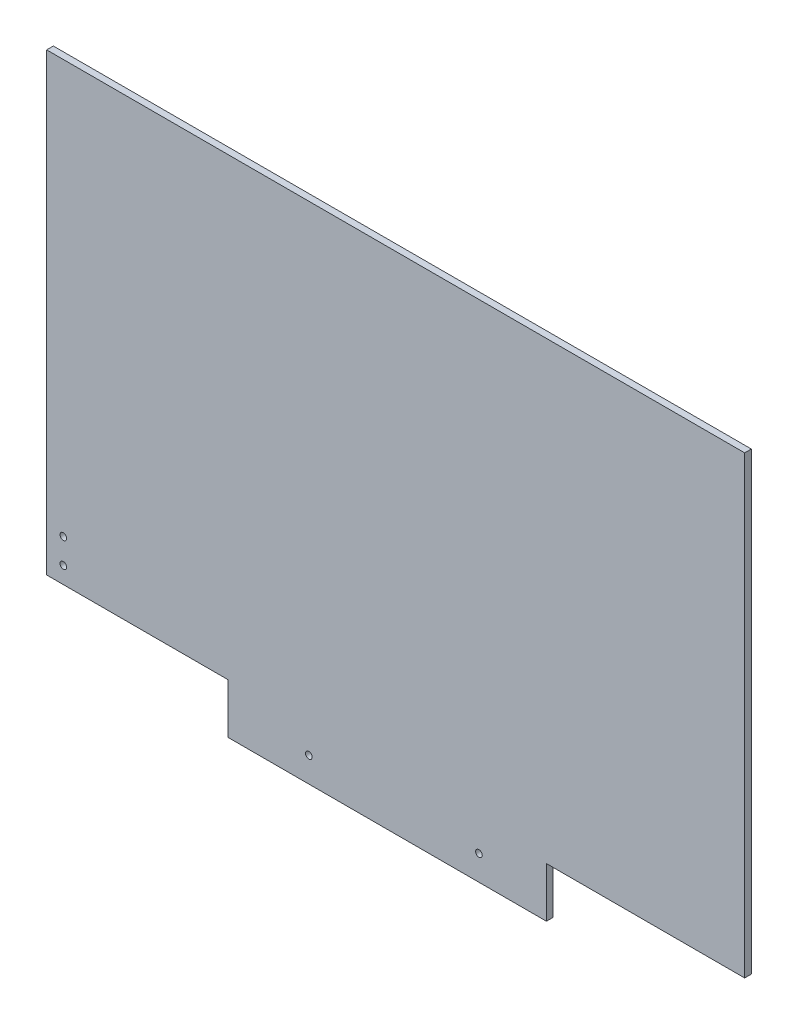
from build123d import *

# Parameters (mm, degrees)
SKETCH1_W           = 419
SKETCH1_H           = 303
BOSS_EXTRUDE1_DEPTH = 4
SKETCH2_W           = 119
SKETCH2_H           = 30
SKETCH2_W_2         = 109
CUT_EXTRUDE1_DEPTH  = 4
SKETCH3_R           = 2
CUT_EXTRUDE2_DEPTH  = 259.570106548
SKETCH4_R           = 2
CUT_EXTRUDE3_DEPTH  = 259.570106548


with BuildPart() as part:
    # Sketch1 → Boss-Extrude1 (new body)
    with BuildSketch(Plane.XY):
        Rectangle(SKETCH1_W, SKETCH1_H)
    extrude(amount=BOSS_EXTRUDE1_DEPTH)

    # Sketch2 → Cut-Extrude1 (cut)
    with BuildSketch(Plane(origin=(0, 0, 0), x_dir=(-1, 0, 0), z_dir=(0, 0, -1))):
        with Locations((-150, -136.5)):
            Rectangle(SKETCH2_W, SKETCH2_H)
        with Locations((155, -136.5)):
            Rectangle(SKETCH2_W_2, SKETCH2_H)
    extrude(amount=-CUT_EXTRUDE1_DEPTH, mode=Mode.SUBTRACT)

    # Sketch3 → Cut-Extrude2 (cut, through all)
    with BuildSketch(Plane(origin=(0, 0, 0), x_dir=(-1, 0, 0), z_dir=(0, 0, -1))):
        with Locations((-49.983602513, -136.5)):
            Circle(SKETCH3_R)
        with Locations((52.125756906, -136.5)):
            Circle(SKETCH3_R)
    extrude(amount=-CUT_EXTRUDE2_DEPTH, mode=Mode.SUBTRACT)

    # Sketch4 → Cut-Extrude3 (cut, through all)
    with BuildSketch(Plane(origin=(0, 0, 0), x_dir=(-1, 0, 0), z_dir=(0, 0, -1))):
        with Locations((199.5, -111.5)):
            Circle(SKETCH4_R)
        with Locations((199.5, -96.5)):
            Circle(SKETCH4_R)
    extrude(amount=-CUT_EXTRUDE3_DEPTH, mode=Mode.SUBTRACT)


solid = part.part
